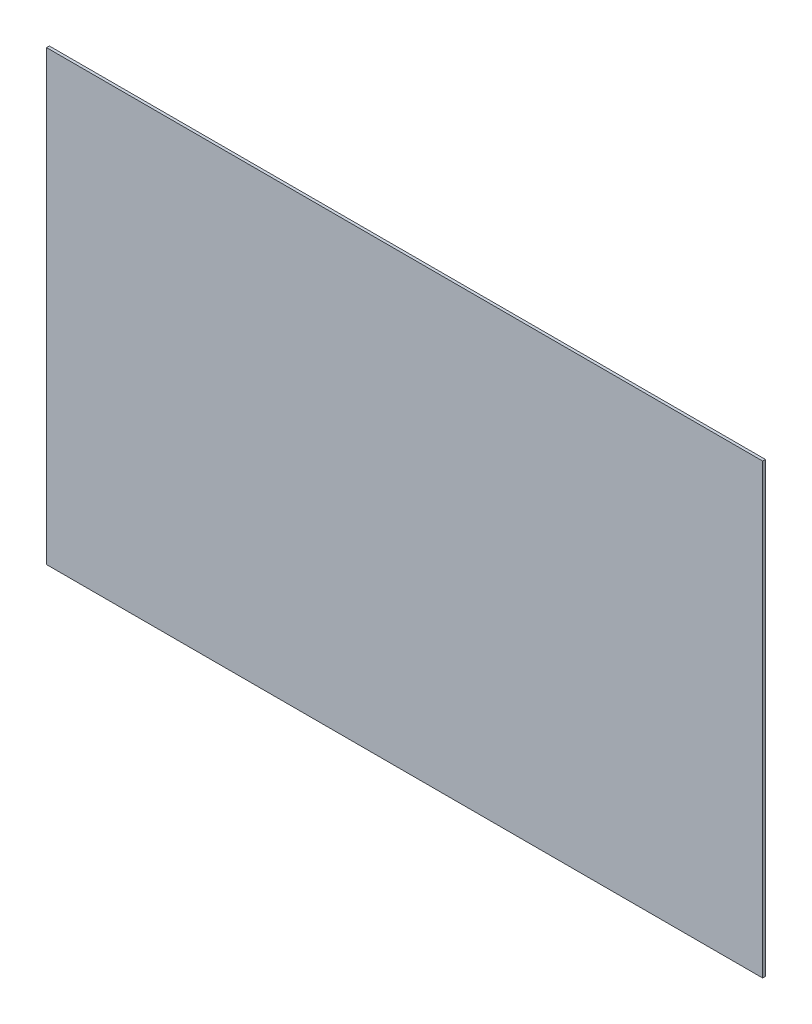
from build123d import *

# Parameters (mm, degrees)
SKETCH1_W           = 812.8
SKETCH1_H           = 508.254
BOSS_EXTRUDE1_DEPTH = 3.175


with BuildPart() as part:
    # Sketch1 → Boss-Extrude1 (new body)
    with BuildSketch(Plane.XY):
        Rectangle(SKETCH1_W, SKETCH1_H)
    extrude(amount=BOSS_EXTRUDE1_DEPTH)


solid = part.part
